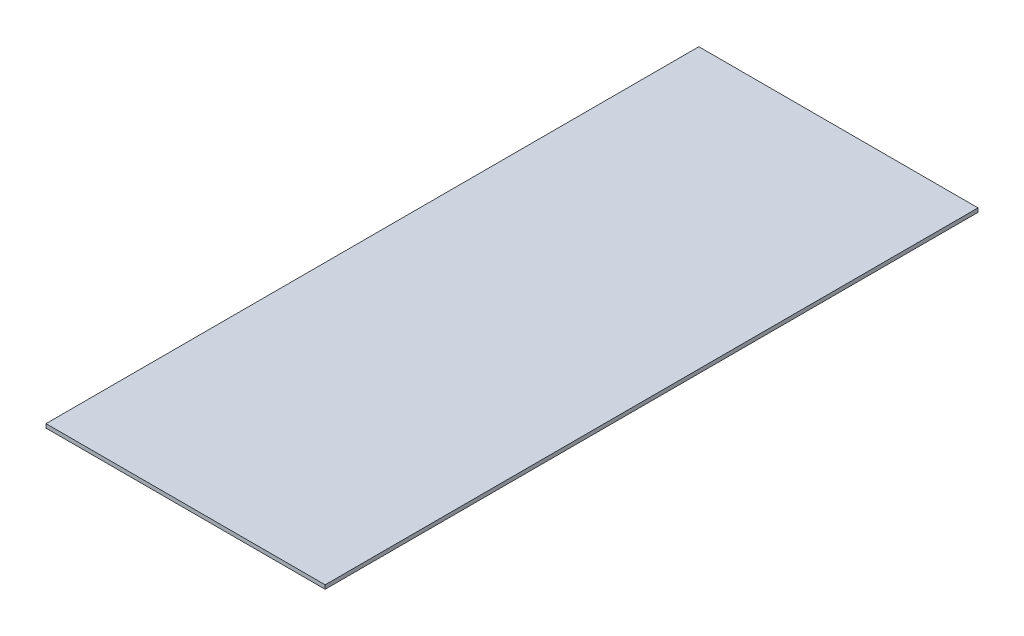
from build123d import *

# Parameters (mm, degrees)
SKETCH1_W           = 393.7
SKETCH1_H           = 920.75
BOSS_EXTRUDE1_DEPTH = 5.5


with BuildPart() as part:
    # Sketch1 → Boss-Extrude1 (new body)
    with BuildSketch(Plane(origin=(0, 0, 0), x_dir=(1, 0, 0), z_dir=(0, 1, 0))):
        with Locations((196.85, -460.375)):
            Rectangle(SKETCH1_W, SKETCH1_H)
    extrude(amount=BOSS_EXTRUDE1_DEPTH)


solid = part.part
